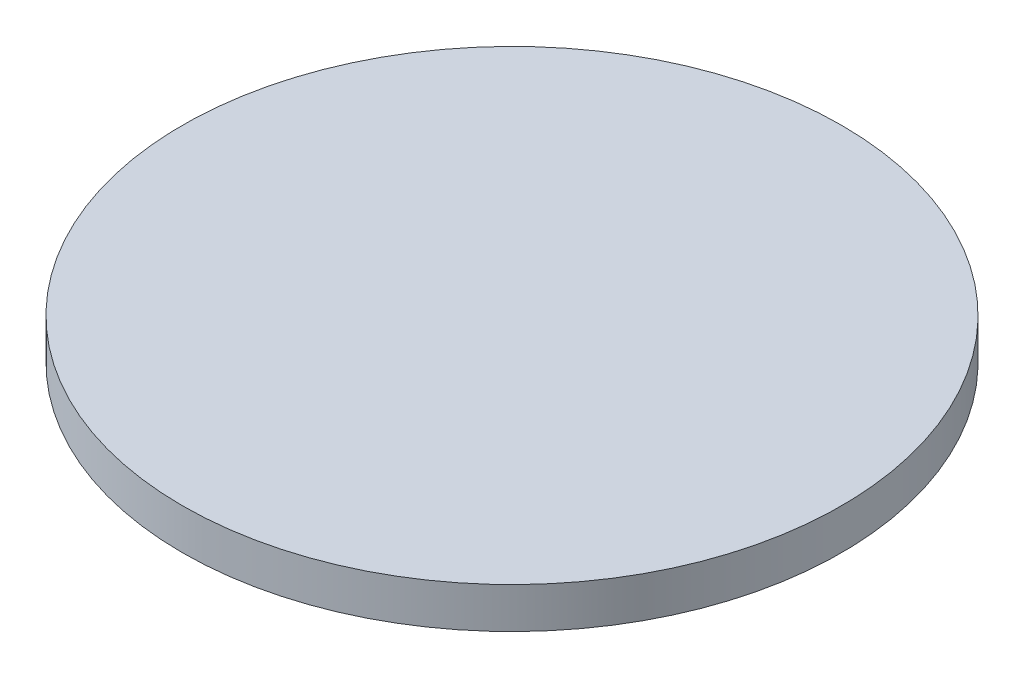
from build123d import *

# Parameters (mm, degrees)
SKETCH1_R           = 19.2786
BOSS_EXTRUDE1_DEPTH = 2.38125


with BuildPart() as part:
    # Sketch1 → Boss-Extrude1 (new body)
    with BuildSketch(Plane(origin=(0, 0, 0), x_dir=(1, 0, 0), z_dir=(0, 1, 0))):
        with Locations(Location((0, 0, 0), (0, 0, 90))):
            Circle(SKETCH1_R)
    extrude(amount=BOSS_EXTRUDE1_DEPTH)


solid = part.part
